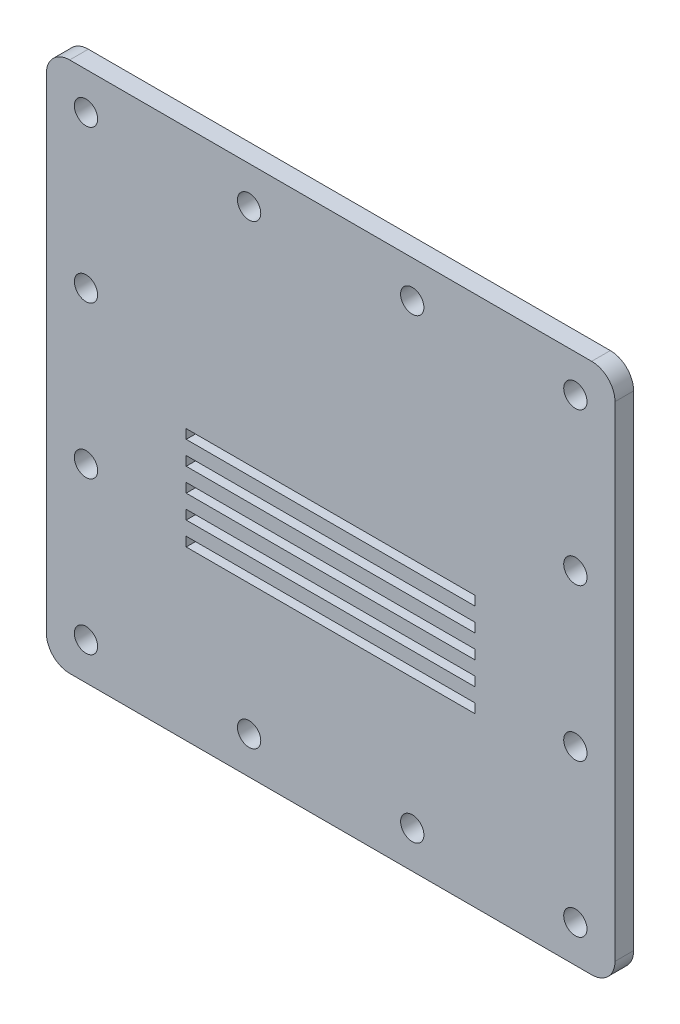
from build123d import *

# Parameters (mm, degrees)
SKETCH1_W           = 61
SKETCH1_H           = 57
BOSS_EXTRUDE1_DEPTH = 2
FILLET1_R           = 2.5
SKETCH2_R           = 1.25
CUT_EXTRUDE1_DEPTH  = 2
SKETCH3_W           = 31
SKETCH3_H           = 1
CUT_EXTRUDE2_DEPTH  = 2


with BuildPart() as part:
    # Sketch1 → Boss-Extrude1 (new body)
    with BuildSketch(Plane.XY):
        Rectangle(SKETCH1_W, SKETCH1_H)
    extrude(amount=BOSS_EXTRUDE1_DEPTH)

    # Fillet1
    fillet1_edges = [part.edges().sort_by_distance(p)[0] for p in [
        (30.5, -28.5, 1),
        (-30.5, -28.5, 1),
        (-30.5, 28.5, 1),
        (30.5, 28.5, 1),
    ]]
    fillet(fillet1_edges, radius=FILLET1_R)

    # Sketch2 → Cut-Extrude1 (cut)
    with BuildSketch(Plane.XY.offset(2)):
        with Locations((-26.25, 24.5)):
            Circle(SKETCH2_R)
        with Locations((-8.75, 24.5)):
            Circle(SKETCH2_R)
        with Locations((8.75, 24.5)):
            Circle(SKETCH2_R)
        with Locations((26.25, 24.5)):
            Circle(SKETCH2_R)
        with Locations((26.25, 8.166666667)):
            Circle(SKETCH2_R)
        with Locations((26.25, -8.166666667)):
            Circle(SKETCH2_R)
        with Locations((-8.75, -24.5)):
            Circle(SKETCH2_R)
        with Locations((8.75, -24.5)):
            Circle(SKETCH2_R)
        with Locations((26.25, -24.5)):
            Circle(SKETCH2_R)
        with Locations((-26.25, 8.166666667)):
            Circle(SKETCH2_R)
        with Locations((-26.25, -8.166666667)):
            Circle(SKETCH2_R)
        with Locations((-26.25, -24.5)):
            Circle(SKETCH2_R)
    extrude(amount=-CUT_EXTRUDE1_DEPTH, mode=Mode.SUBTRACT)

    # Sketch3 → Cut-Extrude2 (cut)
    with BuildSketch(Plane.XY.offset(2)):
        Rectangle(SKETCH3_W, SKETCH3_H)
        with Locations((0, -2.5)):
            Rectangle(SKETCH3_W, SKETCH3_H)
        with Locations((0, -5)):
            Rectangle(SKETCH3_W, SKETCH3_H)
        with Locations((0, -7.5)):
            Rectangle(SKETCH3_W, SKETCH3_H)
        with Locations((0, -10)):
            Rectangle(SKETCH3_W, SKETCH3_H)
    extrude(amount=-CUT_EXTRUDE2_DEPTH, mode=Mode.SUBTRACT)


solid = part.part
